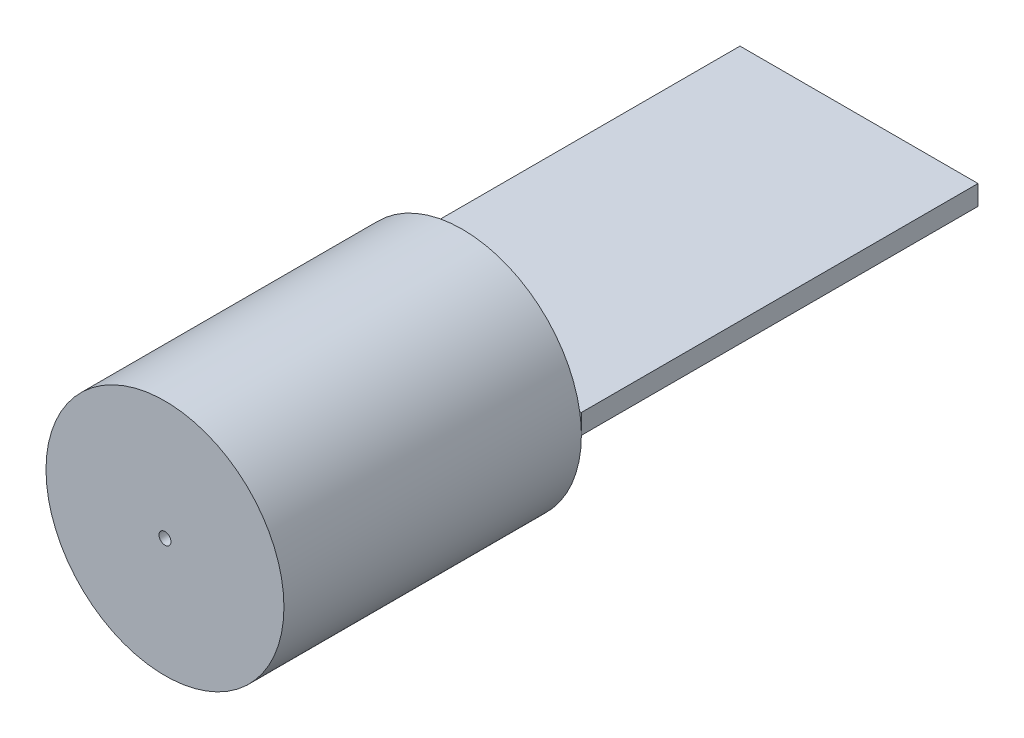
from build123d import *

# Parameters (mm, degrees)
ESQUISSE1_R             = 6
BOSS_EXTRU_1_DEPTH      = 15
ESQUISSE2_R             = 0.3
ENL_V_MAT_EXTRU_1_DEPTH = 3
ESQUISSE3_W             = 12.003336486
ESQUISSE3_H             = 20
BOSS_EXTRU_2_DEPTH      = 1


with BuildPart() as part:
    # Esquisse1 → Boss.-Extru.1 (new body)
    with BuildSketch(Plane.XY):
        Circle(ESQUISSE1_R)
    extrude(amount=BOSS_EXTRU_1_DEPTH)

    # Esquisse2 → Enlèv. mat.-Extru.1 (cut)
    with BuildSketch(Plane.XY.offset(15)):
        Circle(ESQUISSE2_R)
    extrude(amount=-ENL_V_MAT_EXTRU_1_DEPTH, mode=Mode.SUBTRACT)

    # Esquisse3 → Boss.-Extru.2 (add)
    with BuildSketch(Plane(origin=(0, 0, 0), x_dir=(1, 0, 0), z_dir=(0, 1, 0))):
        with Locations((0.001668243, 10)):
            Rectangle(ESQUISSE3_W, ESQUISSE3_H)
    extrude(amount=BOSS_EXTRU_2_DEPTH)


solid = part.part
